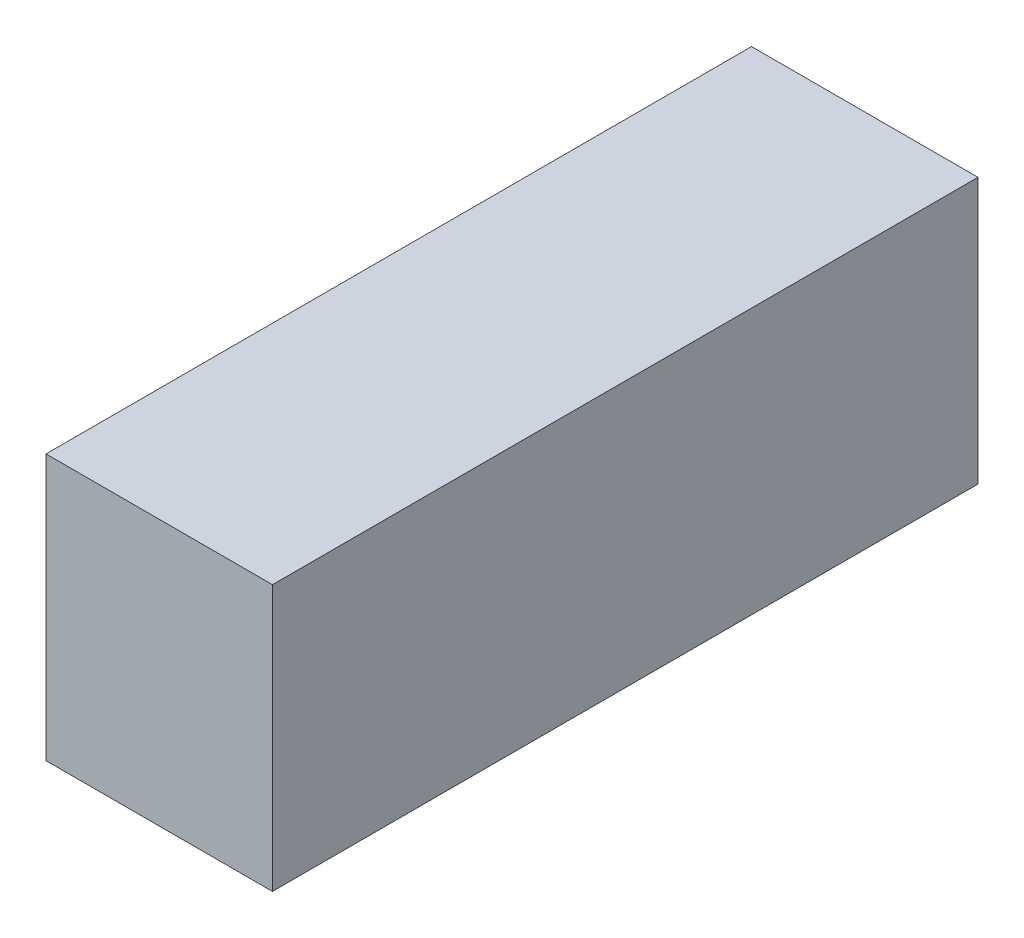
from build123d import *

# Parameters (mm, degrees)
SKETCH1_W           = 52
SKETCH1_H           = 61
BOSS_EXTRUDE1_DEPTH = 162


with BuildPart() as part:
    # Sketch1 → Boss-Extrude1 (new body)
    with BuildSketch(Plane.XY):
        Rectangle(SKETCH1_W, SKETCH1_H)
    extrude(amount=BOSS_EXTRUDE1_DEPTH)


solid = part.part
